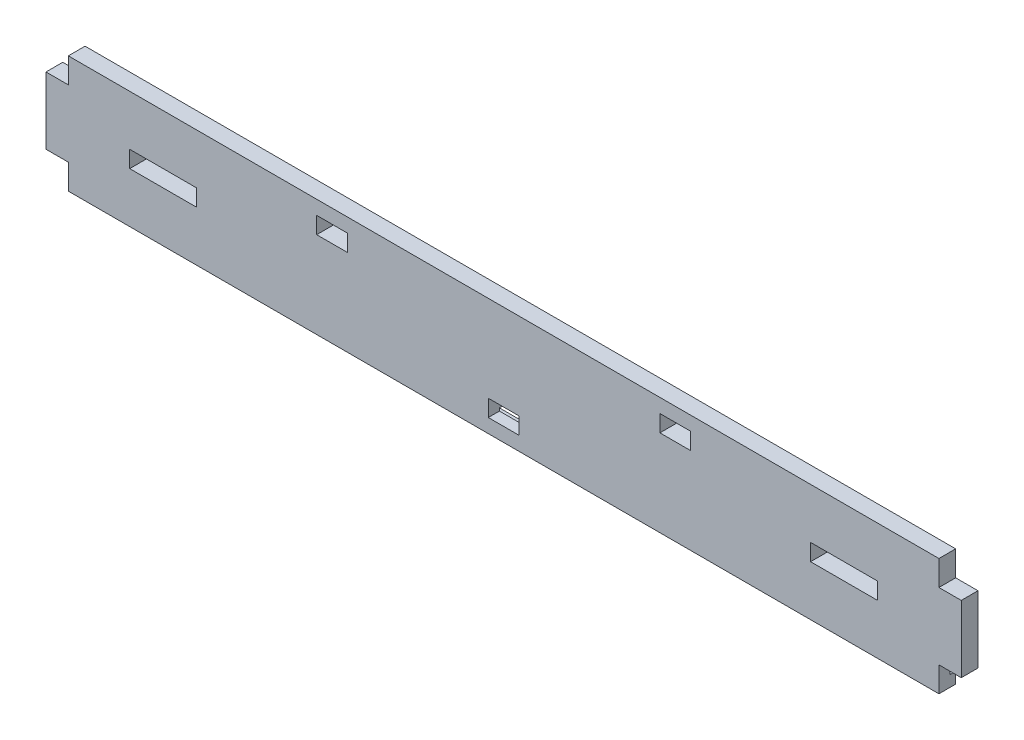
from build123d import *

# Parameters (mm, degrees)
SKETCH1_W           = 19.05
SKETCH1_H           = 133.35
BOSS_EXTRUDE1_DEPTH = 1041.4
SKETCH2_W           = 76.2
SKETCH2_H           = 19.05
SKETCH2_W_2         = 34.925
SKETCH2_W_3         = 25.4
SKETCH2_H_2         = 28.575
CUT_EXTRUDE1_DEPTH  = 1058.779929099
SKETCH3_W           = 6.35
SKETCH3_H           = 6.35
CUT_EXTRUDE2_DEPTH  = 1103.515918102


with BuildPart() as part:
    # Sketch1 → Boss-Extrude1 (new body)
    with BuildSketch(Plane(origin=(0, 0, 0), x_dir=(0, 0, -1), z_dir=(1, 0, 0))):
        with Locations((-301.932659665, 117.774223108)):
            Rectangle(SKETCH1_W, SKETCH1_H)
    extrude(amount=-BOSS_EXTRUDE1_DEPTH)

    # Sketch2 → Cut-Extrude1 (cut, through all)
    with BuildSketch(Plane.XY.offset(311.457659665)):
        with Locations((-908.05, 117.774223108)):
            Rectangle(SKETCH2_W, SKETCH2_H)
        with Locations((-133.35, 117.774223108)):
            Rectangle(SKETCH2_W, SKETCH2_H)
        with Locations((-325.4375, 159.036523108)):
            Rectangle(SKETCH2_W_2, SKETCH2_H)
        with Locations((-715.9625, 159.036523108)):
            Rectangle(SKETCH2_W_2, SKETCH2_H)
        with Locations((-12.7, 170.161723108)):
            Rectangle(SKETCH2_W_3, SKETCH2_H_2)
        with Locations((-1028.7, 170.161723108)):
            Rectangle(SKETCH2_W_3, SKETCH2_H_2)
        with Locations((-520.7, 76.499223108)):
            Rectangle(SKETCH2_W_2, SKETCH2_H)
        with Locations((-1028.7, 65.386723108)):
            Rectangle(SKETCH2_W_3, SKETCH2_H_2)
        with Locations((-12.7, 65.386723108)):
            Rectangle(SKETCH2_W_3, SKETCH2_H_2)
    extrude(amount=-CUT_EXTRUDE1_DEPTH, mode=Mode.SUBTRACT)

    # Sketch3 → Cut-Extrude2 (cut, through all)
    with BuildSketch(Plane.ZY.offset(1041.4)):
        with Locations((295.582659665, 66.974223108)):
            Rectangle(SKETCH3_W, SKETCH3_H)
    extrude(amount=-CUT_EXTRUDE2_DEPTH, mode=Mode.SUBTRACT)


solid = part.part
